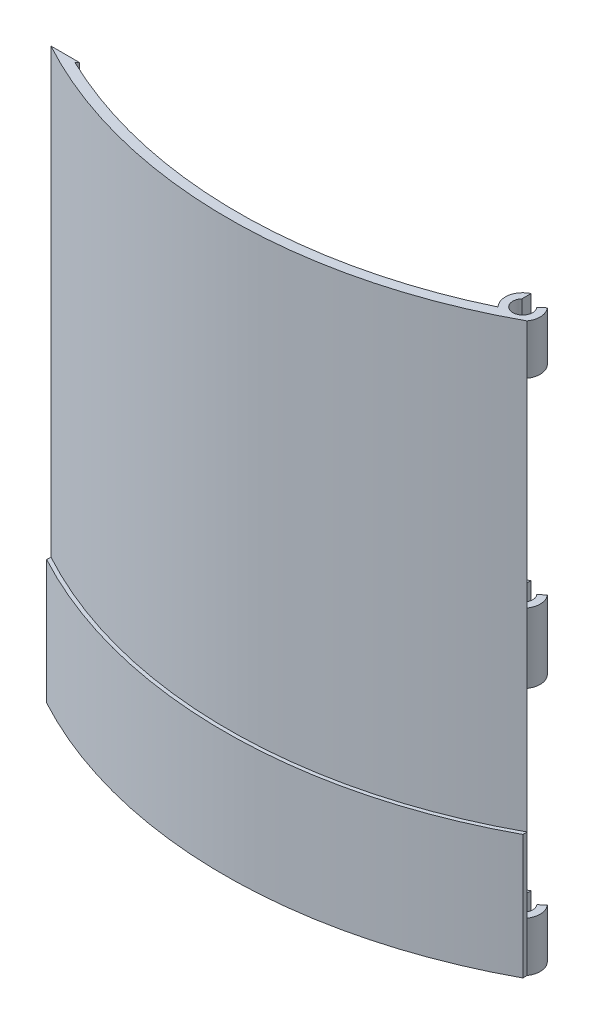
from build123d import *

# Parameters (mm, degrees)
EXTRUDE_1_DEPTH     = 114
EXTRUDE_2_DEPTH     = 25
SKETCH_4_W          = 16.237843285
SKETCH_4_H          = 40
SKETCH_4_W_2        = 18.842025699
SKETCH_4_H_2        = 50
SKETCH_4_W_3        = 19.914336105
CUT_EXTRUDE_1_DEPTH = 20


with BuildPart() as part:
    # 草图1 → 凸台-拉伸1 (new body)
    with BuildSketch(Plane(origin=(0, 0, 0), x_dir=(1, 0, 0), z_dir=(0, 1, 0))):
        with BuildLine():
            Line((90.5, 3.322875656), (90.5, 5.16227766))
            ThreePointArc((90.5, 5.16227766), (88.549473904, 2.586404006), (89.539550125, -0.489214015))
            ThreePointArc((89.539550125, -0.489214015), (47, -10.203390265), (4.460449875, -0.489214015))
            ThreePointArc((4.460449875, -0.489214015), (5.450526096, 2.586404006), (3.5, 5.16227766))
            Line((3.5, 5.16227766), (3.5, 3.322875656))
            ThreePointArc((3.5, 3.322875656), (2, 0), (0.5, 3.322875656))
            Line((0.5, 3.322875656), (0.5, 5.16227766))
            ThreePointArc((0.5, 5.16227766), (-1.382526963, 2.89917259), (-0.872281323, 0))
            ThreePointArc((-0.872281323, 0), (47, -12.203390265), (94.872281323, 0))
            ThreePointArc((94.872281323, 0), (95.494266967, 2.200245764), (94.625, 4.315032397))
            Line((94.625, 4.315032397), (93.5, 3.322875656))
            ThreePointArc((93.5, 3.322875656), (92, 0), (90.5, 3.322875656))
        make_face()
    extrude(amount=EXTRUDE_1_DEPTH)

    # 草图3 → 凸台-拉伸2 (add)
    with BuildSketch(Plane.XZ):
        with BuildLine():
            Line((-0.872281323, 0), (-0.872281323, 0.853303863))
            ThreePointArc((-0.872281323, 0.853303863), (47, 12.953390265), (94.872281323, 0.853303863))
            Line((94.872281323, 0.853303863), (94.872281323, 0))
            ThreePointArc((94.872281323, 0), (47, 12.203390265), (-0.872281323, 0))
        make_face()
    extrude(amount=-EXTRUDE_2_DEPTH)

    # 草图4 → 切除-拉伸1 (cut)
    with BuildSketch(Plane.XY):
        with Locations((92.649785841, 84)):
            Rectangle(SKETCH_4_W, SKETCH_4_H)
        with Locations((92.649785841, 30)):
            Rectangle(SKETCH_4_W, SKETCH_4_H)
        with Locations((0.967246157, 89)):
            Rectangle(SKETCH_4_W_2, SKETCH_4_H_2)
        with Locations((1.50340136, 25)):
            Rectangle(SKETCH_4_W_3, SKETCH_4_H_2)
    extrude(amount=-CUT_EXTRUDE_1_DEPTH, mode=Mode.SUBTRACT)


solid = part.part
